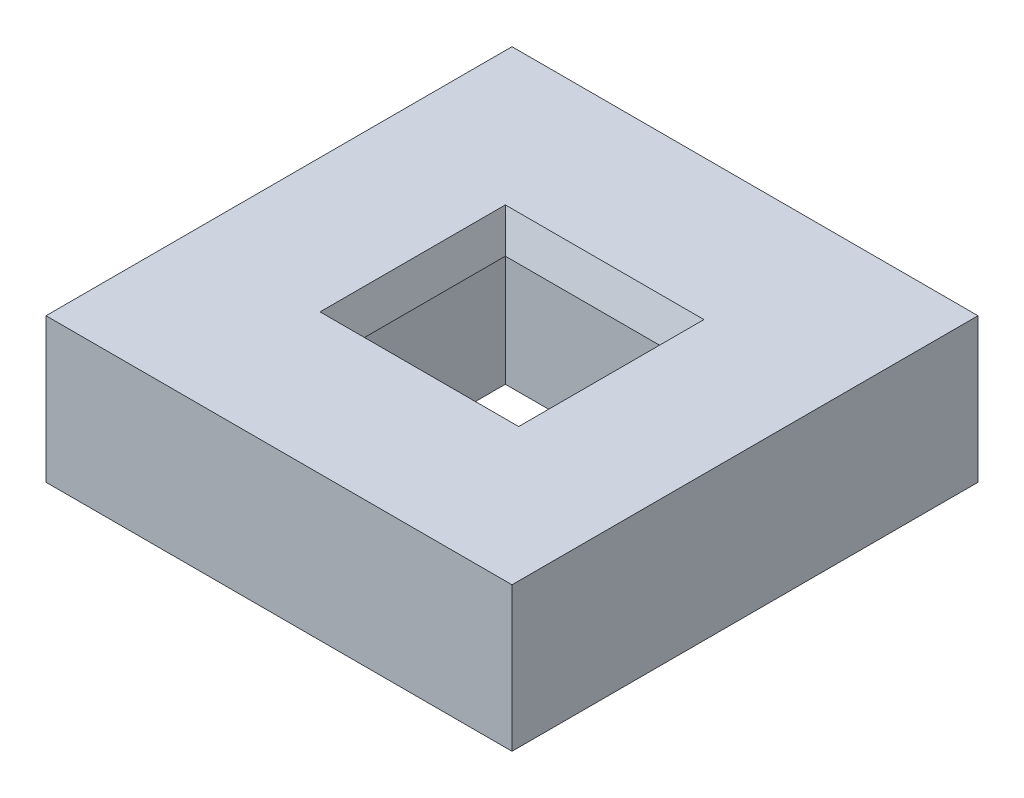
from build123d import *

# Parameters (mm, degrees)
SKETCH1_W           = 21
SKETCH1_H           = 21
SKETCH1_W_2         = 7.95
SKETCH1_H_2         = 7.35
BOSS_EXTRUDE1_DEPTH = 6.5
CHAMFER1_SIZE       = 0.5
CHAMFER1_SIZE2      = 1.5


with BuildPart() as part:
    # Sketch1 → Boss-Extrude1 (new body)
    with BuildSketch(Plane(origin=(0, 0, 0), x_dir=(1, 0, 0), z_dir=(0, 1, 0))):
        Rectangle(SKETCH1_W, SKETCH1_H)
        Rectangle(SKETCH1_W_2, SKETCH1_H_2, mode=Mode.SUBTRACT)
    extrude(amount=BOSS_EXTRUDE1_DEPTH)

    # Chamfer1
    chamfer1_edges = [part.edges().sort_by_distance(p)[0] for p in [
        (-3.975, 6.5, 0),
        (0, 6.5, 3.675),
        (3.975, 6.5, 0),
        (0, 6.5, -3.675),
    ]]
    chamfer1_side = [part.faces().sort_by_distance(p)[0] for p in [
        (0, 6.5, -10.203015152),
    ]]
    chamfer(chamfer1_edges, length=CHAMFER1_SIZE, length2=CHAMFER1_SIZE2, reference=chamfer1_side[0])


solid = part.part
